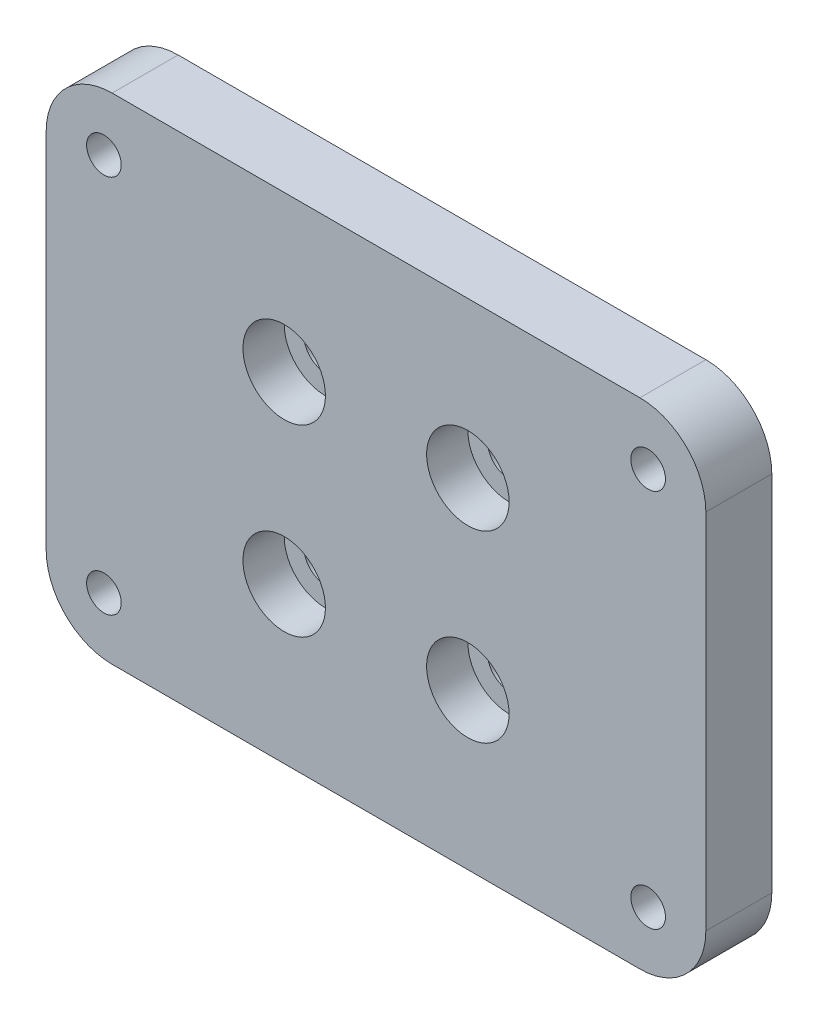
from build123d import *

# Parameters (mm, degrees)
SKETCH_1_W          = 80
SKETCH_1_H          = 60
EXTRUDE_1_DEPTH     = 8
SKETCH_2_R          = 2.6
CUT_EXTRUDE_1_DEPTH = 10
FILLET_1_R          = 8
SKETCH_3_R          = 5
CUT_EXTRUDE_2_DEPTH = 5
SKETCH_5_R          = 2.1
CUT_EXTRUDE_4_DEPTH = 10


with BuildPart() as part:
    # ｽｹｯﾁ1 → ﾎﾞｽ - 押し出し1 (new body)
    with BuildSketch(Plane.XY):
        with Locations((40, 30)):
            Rectangle(SKETCH_1_W, SKETCH_1_H)
    extrude(amount=EXTRUDE_1_DEPTH)

    # ｽｹｯﾁ2 → ｶｯﾄ - 押し出し1 (cut)
    with BuildSketch(Plane.XY.offset(8)):
        with Locations((28.863068196, 41.136931804)):
            Circle(SKETCH_2_R)
        with Locations((51.136931804, 41.136931804)):
            Circle(SKETCH_2_R)
        with Locations((51.136931804, 18.863068196)):
            Circle(SKETCH_2_R)
        with Locations((28.863068196, 18.863068196)):
            Circle(SKETCH_2_R)
    extrude(amount=-CUT_EXTRUDE_1_DEPTH, mode=Mode.SUBTRACT)

    # ﾌｨﾚｯﾄ1
    fillet_1_edges = [part.edges().sort_by_distance(p)[0] for p in [
        (0, 60, 4),
        (80, 60, 4),
        (80, 0, 4),
        (0, 0, 4),
    ]]
    fillet(fillet_1_edges, radius=FILLET_1_R)

    # ｽｹｯﾁ3 → ｶｯﾄ - 押し出し2 (cut)
    with BuildSketch(Plane.XY.offset(8)):
        with Locations((28.863068196, 41.136931804)):
            Circle(SKETCH_3_R)
        with Locations((51.136931804, 41.136931804)):
            Circle(SKETCH_3_R)
        with Locations((28.863068196, 18.863068196)):
            Circle(SKETCH_3_R)
        with Locations((51.136931804, 18.863068196)):
            Circle(SKETCH_3_R)
    extrude(amount=-CUT_EXTRUDE_2_DEPTH, mode=Mode.SUBTRACT)

    # ｽｹｯﾁ5 → ｶｯﾄ - 押し出し4 (cut)
    with BuildSketch(Plane.XY.offset(8)):
        with Locations((7, 53)):
            Circle(SKETCH_5_R)
        with Locations((73, 53)):
            Circle(SKETCH_5_R)
        with Locations((73, 7)):
            Circle(SKETCH_5_R)
        with Locations((7, 7)):
            Circle(SKETCH_5_R)
    extrude(amount=-CUT_EXTRUDE_4_DEPTH, mode=Mode.SUBTRACT)


solid = part.part
